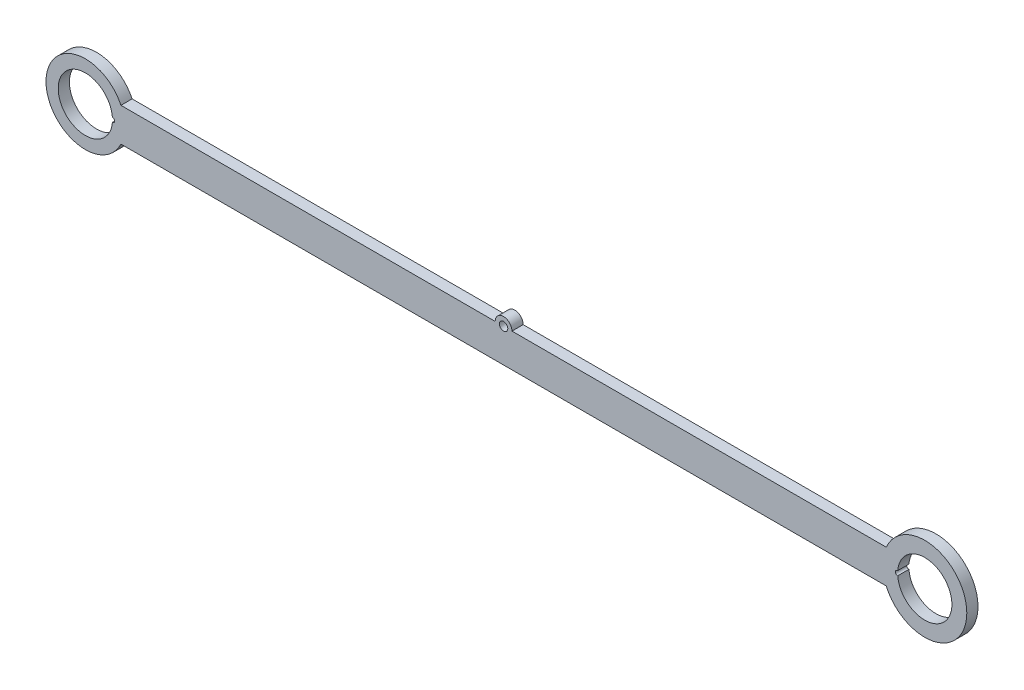
from build123d import *

# Parameters (mm, degrees)
SKETCH_1_R          = 9.7
EXTRUDE_1_DEPTH     = 4
SKETCH_3_R          = 0.8
CUT_EXTRUDE_1_DEPTH = 10
SKETCH_4_R          = 3
EXTRUDE_2_DEPTH     = 4
SKETCH_5_R          = 1.5
CUT_EXTRUDE_2_DEPTH = 4


with BuildPart() as part:
    # 草图1 → 凸台-拉伸1 (new body)
    with BuildSketch(Plane.XY):
        with BuildLine():
            Line((12.718684308, 6), (286.224480753, 6))
            ThreePointArc((286.224480753, 6), (315.02547605, 0), (286.224480753, -6))
            Line((286.224480753, -6), (12.718684308, -6))
            ThreePointArc((12.718684308, -6), (-14.062891969, 0), (12.718684308, 6))
        make_face()
        Circle(SKETCH_1_R, mode=Mode.SUBTRACT)
        with Locations((300, 0)):
            Circle(SKETCH_1_R, mode=Mode.SUBTRACT)
    extrude(amount=EXTRUDE_1_DEPTH)

    # 草图3 → 切除-拉伸1 (cut)
    with BuildSketch(Plane.XY.offset(4)):
        with Locations((9.7, 0)):
            Circle(SKETCH_3_R)
        with Locations((290.3, 0)):
            Circle(SKETCH_3_R)
    extrude(amount=-CUT_EXTRUDE_1_DEPTH, mode=Mode.SUBTRACT)

    # 草图4 → 凸台-拉伸2 (add)
    with BuildSketch(Plane.XY.offset(4)):
        with Locations((149.47158253, 6)):
            Circle(SKETCH_4_R)
    extrude(amount=-EXTRUDE_2_DEPTH)

    # 草图5 → 切除-拉伸2 (cut)
    with BuildSketch(Plane.XY.offset(4)):
        with Locations((149.47158253, 6)):
            Circle(SKETCH_5_R)
    extrude(amount=-CUT_EXTRUDE_2_DEPTH, mode=Mode.SUBTRACT)


solid = part.part
